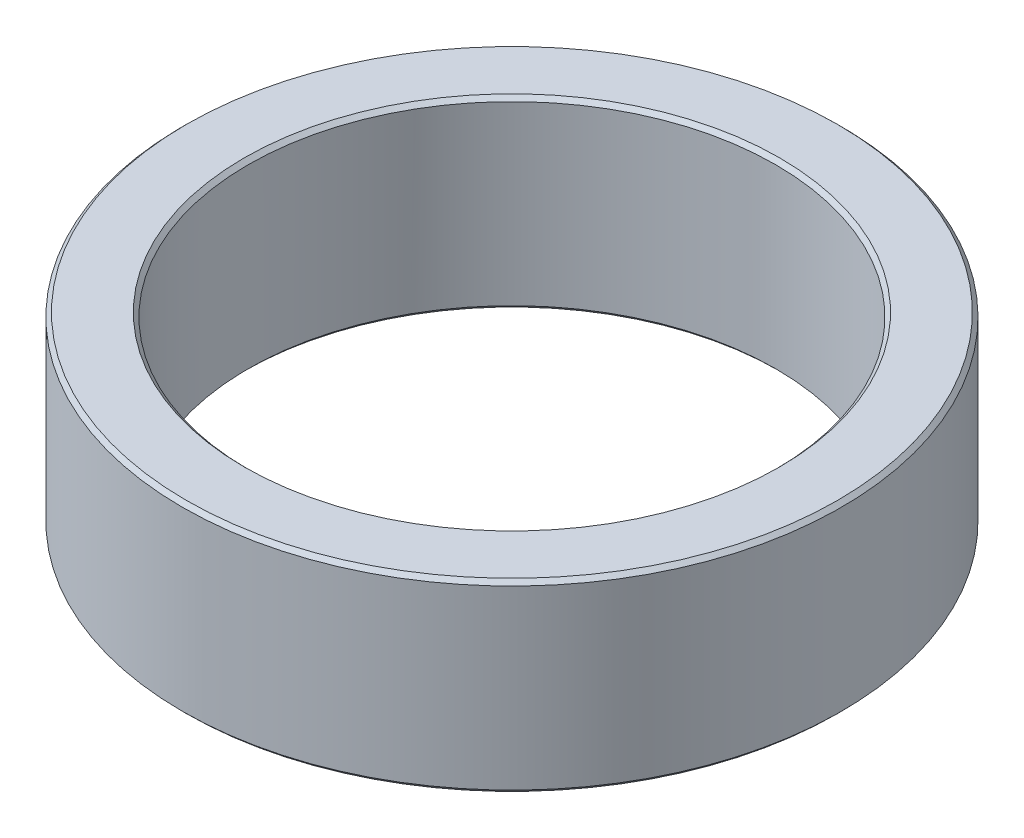
from build123d import *

# Parameters (mm, degrees)
SKETCH1_R           = 12.495
SKETCH1_R_2         = 10
BOSS_EXTRUDE1_DEPTH = 7
CHAMFER1_SIZE       = 0.15


with BuildPart() as part:
    # Sketch1 → Boss-Extrude1 (new body)
    with BuildSketch(Plane(origin=(0, 0, 0), x_dir=(1, 0, 0), z_dir=(0, 1, 0))):
        with Locations(Location((0, 0, 0), (0, 0, 270))):
            Circle(SKETCH1_R)
        with Locations(Location((0, 0, 0), (0, 0, 270))):
            Circle(SKETCH1_R_2, mode=Mode.SUBTRACT)
    extrude(amount=BOSS_EXTRUDE1_DEPTH)

    # Chamfer1
    chamfer1_edges = [part.edges().sort_by_distance(p)[0] for p in [
        (0, 0, -12.495),
        (0, 7, -12.495),
        (0, 0, -10),
        (0, 7, -10),
    ]]
    chamfer(chamfer1_edges, length=CHAMFER1_SIZE)


solid = part.part
